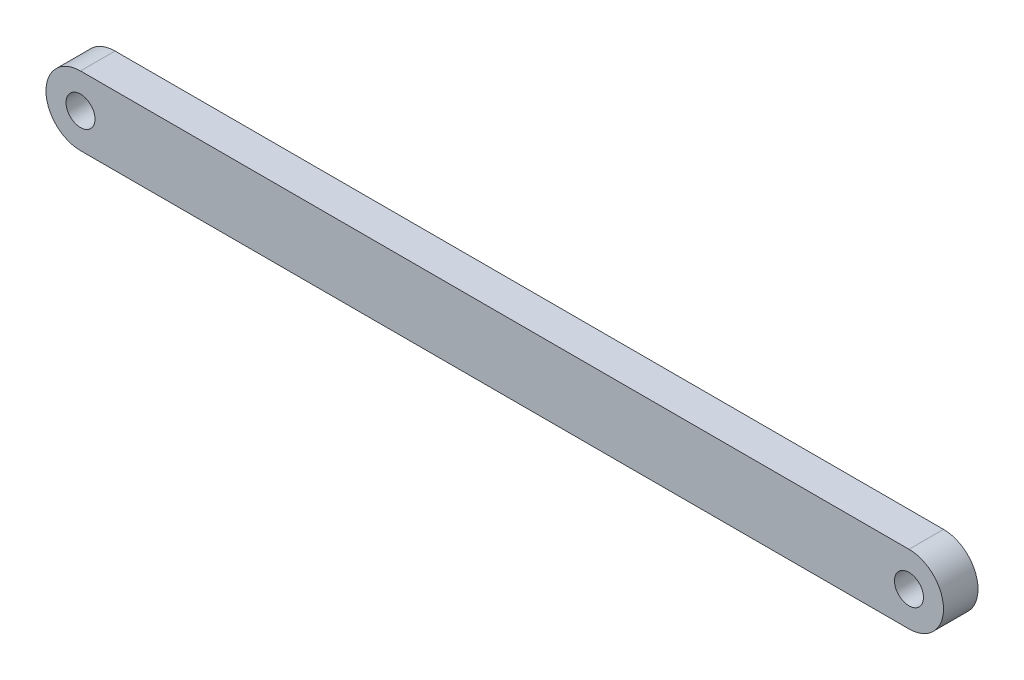
from build123d import *

# Parameters (mm, degrees)
BOSS_EXTRUDE1_DEPTH = 3
SKETCH2_W           = 155.927688531
SKETCH2_H           = 55.200678057
CUT_EXTRUDE1_DEPTH  = 1
SKETCH3_R           = 2.1
CUT_EXTRUDE2_DEPTH  = 66.383484153


with BuildPart() as part:
    # Sketch1 → Boss-Extrude1 (new, symmetric)
    with BuildSketch(Plane.XY):
        with BuildLine():
            Line((60, 5), (-60, 5))
            ThreePointArc((-60, 5), (-65, 0), (-60, -5))
            Line((-60, -5), (60, -5))
            ThreePointArc((60, -5), (65, 0), (60, 5))
        make_face()
    extrude(amount=BOSS_EXTRUDE1_DEPTH, both=True)

    # Sketch2 → Cut-Extrude1 (cut)
    with BuildSketch(Plane.XY.offset(3)):
        with Locations((-0.853618733, 0.071134895)):
            Rectangle(SKETCH2_W, SKETCH2_H)
    extrude(amount=-CUT_EXTRUDE1_DEPTH, mode=Mode.SUBTRACT)

    # Sketch3 → Cut-Extrude2 (cut, through all)
    with BuildSketch(Plane(origin=(0, 0, -3), x_dir=(-1, 0, 0), z_dir=(0, 0, -1))):
        with Locations((-60, 0)):
            Circle(SKETCH3_R)
        with Locations((60, 0)):
            Circle(SKETCH3_R)
    extrude(amount=-CUT_EXTRUDE2_DEPTH, mode=Mode.SUBTRACT)


solid = part.part
